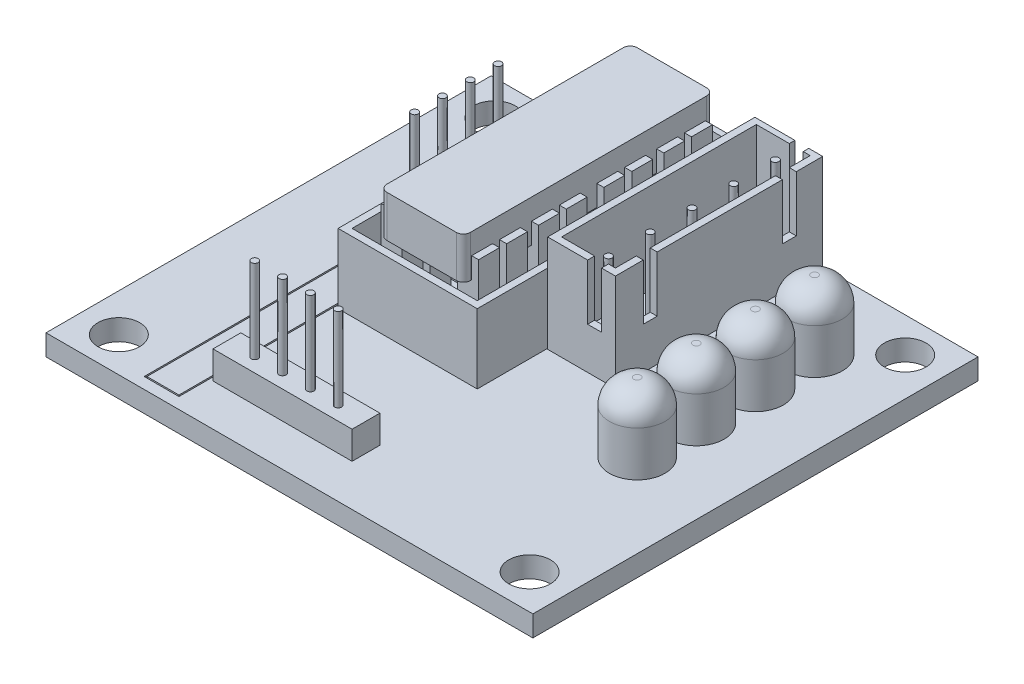
from build123d import *

# Parameters (mm, degrees)
IZIM1_W                           = 35
IZIM1_H                           = 32
IZIM1_R                           = 1.5
Y_KSEKLIK_EKSTR_ZYON1_DEPTH       = 1.5
IZIM2_W                           = 10
IZIM2_H                           = 20
IZIM2_W_2                         = 9
IZIM2_H_2                         = 19
Y_KSEKLIK_EKSTR_ZYON2_DEPTH       = 5
IZIM3_W                           = 4.871859272
IZIM3_H                           = 15
IZIM3_W_2                         = 3.871859272
IZIM3_H_2                         = 14
Y_KSEKLIK_EKSTR_ZYON3_DEPTH       = 7
IZIM4_W                           = 0.5
IZIM4_H                           = 1
IZIM4_W_2                         = 1
IZIM4_H_2                         = 0.5
KES_EKSTR_ZYON1_DEPTH             = 4
IZIM5_W                           = 3.871859272
IZIM5_H                           = 14
Y_KSEKLIK_EKSTR_ZYON4_DEPTH       = 0.5
IZIM6_R                           = 0.25
Y_KSEKLIK_EKSTR_ZYON5_DEPTH       = 6
IZIM7_W                           = 2
IZIM7_H                           = 10
Y_KSEKLIK_EKSTR_ZYON6_DEPTH       = 2
IZIM8_R                           = 0.25
Y_KSEKLIK_EKSTR_ZYON7_DEPTH       = 6
IZIM9_W                           = 10
IZIM9_H                           = 2
Y_KSEKLIK_EKSTR_ZYON8_DEPTH       = 2
IZIM10_R                          = 0.25
Y_KSEKLIK_EKSTR_ZYON9_DEPTH       = 6
IZIM11_R                          = 2
KES_EKSTR_ZYON2_DEPTH             = 0.02
Y_KSEKLIK_EKSTR_ZYON10_START      = 5
IZIM13_R                          = 2
Y_KSEKLIK_EKSTR_ZYON10_DEPTH      = 5
RADYUS1_R                         = 1.75
IZIM14_R                          = 0.5
Y_KSEKLIK_EKSTR_ZYON11_DEPTH      = 4
Y_KSEKLIK_EKSTR_ZYON12_DEPTH      = 1.5
Y_KSEKLIK_EKSTR_ZYON12_DEPTH_BACK = 1.5
IZIM16_W                          = 1.5
IZIM16_H                          = 1.5
IZIM16_W_2                        = 1.525833906
Y_KSEKLIK_EKSTR_ZYON13_DEPTH      = 6.5
IZIM17_W                          = 2.5
IZIM17_H                          = 28.321783011
IZIM17_W_2                        = 2.3
IZIM17_H_2                        = 28.121783011
KES_EKSTR_ZYON3_DEPTH             = 0.1
IZIM19_W                          = 10
IZIM19_H                          = 5
KES_EKSTR_ZYON5_DEPTH             = 0.1
IZIM20_W                          = 4.871859272
IZIM20_H                          = 7
KES_EKSTR_ZYON6_DEPTH             = 0.1


with BuildPart() as part:
    # Çizim1 → Yükseklik-Ekstrüzyon1 (new body)
    with BuildSketch(Plane(origin=(0, 0, 0), x_dir=(1, 0, 0), z_dir=(0, 1, 0))):
        Rectangle(IZIM1_W, IZIM1_H)
        with Locations(Location((-14.765625, 13.5, 0), (0, 0, 270))):
            Circle(IZIM1_R, mode=Mode.SUBTRACT)
        with Locations(Location((-14.765625, -13.5, 0), (0, 0, 90))):
            Circle(IZIM1_R, mode=Mode.SUBTRACT)
        with Locations(Location((14.765625, -13.5, 0), (0, 0, 270))):
            Circle(IZIM1_R, mode=Mode.SUBTRACT)
        with Locations(Location((14.765625, 13.5, 0), (0, 0, 90))):
            Circle(IZIM1_R, mode=Mode.SUBTRACT)
    extrude(amount=Y_KSEKLIK_EKSTR_ZYON1_DEPTH)

    # Çizim2 → Yükseklik-Ekstrüzyon2 (add)
    with BuildSketch(Plane(origin=(0, 1.5, 0), x_dir=(1, 0, 0), z_dir=(0, 1, 0))):
        with Locations((-3.5, 6)):
            Rectangle(IZIM2_W, IZIM2_H)
        with Locations((-3.5, 6)):
            Rectangle(IZIM2_W_2, IZIM2_H_2, mode=Mode.SUBTRACT)
    extrude(amount=Y_KSEKLIK_EKSTR_ZYON2_DEPTH)

    # Çizim3 → Yükseklik-Ekstrüzyon3 (add)
    with BuildSketch(Plane(origin=(0, 1.5, 0), x_dir=(1, 0, 0), z_dir=(0, 1, 0))):
        with Locations((4, 8.5)):
            Rectangle(IZIM3_W, IZIM3_H)
        with Locations((4, 8.5)):
            Rectangle(IZIM3_W_2, IZIM3_H_2, mode=Mode.SUBTRACT)
    extrude(amount=Y_KSEKLIK_EKSTR_ZYON3_DEPTH)

    # Çizim4 → Kes-Ekstrüzyon1 (cut)
    with BuildSketch(Plane(origin=(0, 8.5, 0), x_dir=(1, 0, 0), z_dir=(0, 1, 0))):
        with Locations((6.185929636, 3.5)):
            Rectangle(IZIM4_W, IZIM4_H)
        with Locations((6.185929636, 13.5)):
            Rectangle(IZIM4_W, IZIM4_H)
        with Locations((4.935929636, 1.25)):
            Rectangle(IZIM4_W_2, IZIM4_H_2)
        with Locations((4.935929636, 15.75)):
            Rectangle(IZIM4_W_2, IZIM4_H_2)
    extrude(amount=-KES_EKSTR_ZYON1_DEPTH, mode=Mode.SUBTRACT)

    # Çizim5 → Yükseklik-Ekstrüzyon4 (add)
    with BuildSketch(Plane(origin=(0, 1.5, 0), x_dir=(1, 0, 0), z_dir=(0, 1, 0))):
        with Locations((4, 8.5)):
            Rectangle(IZIM5_W, IZIM5_H)
    extrude(amount=Y_KSEKLIK_EKSTR_ZYON4_DEPTH)

    # Çizim6 → Yükseklik-Ekstrüzyon5 (add)
    with BuildSketch(Plane(origin=(0, 2, 0), x_dir=(1, 0, 0), z_dir=(0, 1, 0))):
        with Locations(Location((4.435929636, 8.5, 0), (0, 0, 270))):
            Circle(IZIM6_R)
        with Locations(Location((4.435929636, 11.5, 0), (0, 0, 270))):
            Circle(IZIM6_R)
        with Locations(Location((4.435929636, 14.5, 0), (0, 0, 270))):
            Circle(IZIM6_R)
        with Locations(Location((4.435929636, 5.5, 0), (0, 0, 270))):
            Circle(IZIM6_R)
        with Locations(Location((4.435929636, 2.5, 0), (0, 0, 270))):
            Circle(IZIM6_R)
    extrude(amount=Y_KSEKLIK_EKSTR_ZYON5_DEPTH)

    # Çizim7 → Yükseklik-Ekstrüzyon6 (add)
    with BuildSketch(Plane(origin=(0, 1.5, 0), x_dir=(1, 0, 0), z_dir=(0, 1, 0))):
        with Locations((-10, 6)):
            Rectangle(IZIM7_W, IZIM7_H)
    extrude(amount=Y_KSEKLIK_EKSTR_ZYON6_DEPTH)

    # Çizim8 → Yükseklik-Ekstrüzyon7 (add)
    with BuildSketch(Plane(origin=(0, 3.5, 0), x_dir=(1, 0, 0), z_dir=(0, 1, 0))):
        with Locations(Location((-10, 7, 0), (0, 0, 90))):
            Circle(IZIM8_R)
        with Locations(Location((-10, 9, 0), (0, 0, 90))):
            Circle(IZIM8_R)
        with Locations(Location((-10, 3, 0), (0, 0, 90))):
            Circle(IZIM8_R)
        with Locations(Location((-10, 5, 0), (0, 0, 90))):
            Circle(IZIM8_R)
    extrude(amount=Y_KSEKLIK_EKSTR_ZYON7_DEPTH)

    # Çizim9 → Yükseklik-Ekstrüzyon8 (add)
    with BuildSketch(Plane(origin=(0, 1.5, 0), x_dir=(1, 0, 0), z_dir=(0, 1, 0))):
        with Locations((-3.495677599, -12)):
            Rectangle(IZIM9_W, IZIM9_H)
    extrude(amount=Y_KSEKLIK_EKSTR_ZYON8_DEPTH)

    # Çizim10 → Yükseklik-Ekstrüzyon9 (add)
    with BuildSketch(Plane(origin=(0, 3.5, 0), x_dir=(1, 0, 0), z_dir=(0, 1, 0))):
        with Locations(Location((-4.495677599, -12, 0), (0, 0, 270))):
            Circle(IZIM10_R)
        with Locations(Location((-6.495677599, -12, 0), (0, 0, 270))):
            Circle(IZIM10_R)
        with Locations(Location((-2.495677599, -12, 0), (0, 0, 90))):
            Circle(IZIM10_R)
        with Locations(Location((-0.495677599, -12, 0), (0, 0, 90))):
            Circle(IZIM10_R)
    extrude(amount=Y_KSEKLIK_EKSTR_ZYON9_DEPTH)

    # Çizim11 → Kes-Ekstrüzyon2 (cut)
    with BuildSketch(Plane(origin=(0, 1.5, 0), x_dir=(1, 0, 0), z_dir=(0, 1, 0))):
        with Locations(Location((11.5, 10.25, 0), (0, 0, 270))):
            Circle(IZIM11_R)
        with Locations(Location((11.5, 6, 0), (0, 0, 270))):
            Circle(IZIM11_R)
        with Locations(Location((11.5, 1.75, 0), (0, 0, 270))):
            Circle(IZIM11_R)
        with Locations(Location((11.5, -2.5, 0), (0, 0, 270))):
            Circle(IZIM11_R)
    extrude(amount=-KES_EKSTR_ZYON2_DEPTH, mode=Mode.SUBTRACT)

    # Çizim13 → Yükseklik-Ekstrüzyon10 (add)
    with BuildSketch(Plane(origin=(0, 1.48, 0), x_dir=(1, 0, 0), z_dir=(0, 1, 0)).offset(Y_KSEKLIK_EKSTR_ZYON10_START)):
        with Locations(Location((11.5, 10.25, 0), (0, 0, 270))):
            Circle(IZIM13_R)
        with Locations(Location((11.5, 6, 0), (0, 0, 270))):
            Circle(IZIM13_R)
        with Locations(Location((11.5, 1.75, 0), (0, 0, 270))):
            Circle(IZIM13_R)
        with Locations(Location((11.5, -2.5, 0), (0, 0, 270))):
            Circle(IZIM13_R)
    extrude(amount=-Y_KSEKLIK_EKSTR_ZYON10_DEPTH)

    # Radyus1
    radyus1_edges = [part.edges().sort_by_distance(p)[0] for p in [
        (11.5, 6.48, -12.25),
        (11.5, 6.48, -8),
        (11.5, 6.48, -3.75),
        (11.5, 6.48, 0.5),
    ]]
    fillet(radyus1_edges, radius=RADYUS1_R)

    # Çizim14 → Yükseklik-Ekstrüzyon11 (add)
    with BuildSketch(Plane.XZ):
        with Locations((11.5, -10.25)):
            Circle(IZIM14_R)
        with Locations((11.5, -6)):
            Circle(IZIM14_R)
        with Locations((11.5, -1.75)):
            Circle(IZIM14_R)
        with Locations((11.5, 2.5)):
            Circle(IZIM14_R)
    extrude(amount=-Y_KSEKLIK_EKSTR_ZYON11_DEPTH)



with BuildPart() as body_2:
    # Çizim15 → Yükseklik-Ekstrüzyon12 (new, two sides: drawn at the far end of the back side and taken through both)
    with BuildSketch(Plane(origin=(0, 8, 0), x_dir=(1, 0, 0), z_dir=(0, 1, 0)).offset(-Y_KSEKLIK_EKSTR_ZYON12_DEPTH_BACK)):
        with BuildLine():
            Line((-6, 15), (-1, 15))
            ThreePointArc((-1, 15), (-0.646446609, 14.853553391), (-0.5, 14.5))
            Line((-0.5, 14.5), (-0.5, -2.5))
            ThreePointArc((-0.5, -2.5), (-0.646446609, -2.853553391), (-1, -3))
            Line((-1, -3), (-6, -3))
            ThreePointArc((-6, -3), (-6.353553391, -2.853553391), (-6.5, -2.5))
            Line((-6.5, -2.5), (-6.5, 14.5))
            ThreePointArc((-6.5, 14.5), (-6.353553391, 14.853553391), (-6, 15))
        make_face()
    extrude(amount=Y_KSEKLIK_EKSTR_ZYON12_DEPTH + Y_KSEKLIK_EKSTR_ZYON12_DEPTH_BACK)


with BuildPart() as part_1:
    add(part.part)

    add(body_2.part)  # Yükseklik-Ekstrüzyon13 merges body 2
    # Çizim16 → Yükseklik-Ekstrüzyon13 (add)
    with BuildSketch(Plane(origin=(0, 1.5, 0), x_dir=(1, 0, 0), z_dir=(0, 1, 0))):
        with Locations((-0.75, 7.35)):
            Rectangle(IZIM16_W, IZIM16_H)
        with Locations((-0.75, 13.65)):
            Rectangle(IZIM16_W, IZIM16_H)
        with Locations((-0.75, 9.35)):
            Rectangle(IZIM16_W_2, IZIM16_H)
        with Locations((-0.75, 11.65)):
            Rectangle(IZIM16_W_2, IZIM16_H)
        with Locations((-6.25, 7.35)):
            Rectangle(IZIM16_W, IZIM16_H)
        with Locations((-6.25, 9.35)):
            Rectangle(IZIM16_W_2, IZIM16_H)
        with Locations((-6.25, 11.65)):
            Rectangle(IZIM16_W_2, IZIM16_H)
        with Locations((-6.25, 13.65)):
            Rectangle(IZIM16_W, IZIM16_H)
        with Locations((-6.25, -1.65)):
            Rectangle(IZIM16_W, IZIM16_H)
        with Locations((-6.25, 0.35)):
            Rectangle(IZIM16_W_2, IZIM16_H)
        with Locations((-6.25, 2.65)):
            Rectangle(IZIM16_W_2, IZIM16_H)
        with Locations((-6.25, 4.65)):
            Rectangle(IZIM16_W, IZIM16_H)
        with Locations((-0.75, 4.65)):
            Rectangle(IZIM16_W, IZIM16_H)
        with Locations((-0.75, 2.65)):
            Rectangle(IZIM16_W_2, IZIM16_H)
        with Locations((-0.75, 0.35)):
            Rectangle(IZIM16_W_2, IZIM16_H)
        with Locations((-0.75, -1.65)):
            Rectangle(IZIM16_W, IZIM16_H)
    extrude(amount=Y_KSEKLIK_EKSTR_ZYON13_DEPTH)

    # Çizim17 → Kes-Ekstrüzyon3 (cut)
    with BuildSketch(Plane(origin=(0, 1.5, 0), x_dir=(1, 0, 0), z_dir=(0, 1, 0))):
        with Locations((-10, -1.031856641)):
            Rectangle(IZIM17_W, IZIM17_H)
        with Locations((-10, -1.031856641)):
            Rectangle(IZIM17_W_2, IZIM17_H_2, mode=Mode.SUBTRACT)
    extrude(amount=-KES_EKSTR_ZYON3_DEPTH, mode=Mode.SUBTRACT)

    # Çizim19 → Kes-Ekstrüzyon5 (cut)
    with BuildSketch(Plane(origin=(0, 0, -16), x_dir=(-1, 0, 0), z_dir=(0, 0, -1))):
        with Locations((3.5, 4)):
            Rectangle(IZIM19_W, IZIM19_H)
    extrude(amount=-KES_EKSTR_ZYON5_DEPTH, mode=Mode.SUBTRACT)

    # Çizim20 → Kes-Ekstrüzyon6 (cut)
    with BuildSketch(Plane(origin=(0, 0, -16), x_dir=(-1, 0, 0), z_dir=(0, 0, -1))):
        with Locations((-4, 5)):
            Rectangle(IZIM20_W, IZIM20_H)
    extrude(amount=-KES_EKSTR_ZYON6_DEPTH, mode=Mode.SUBTRACT)


solid = part_1.part
